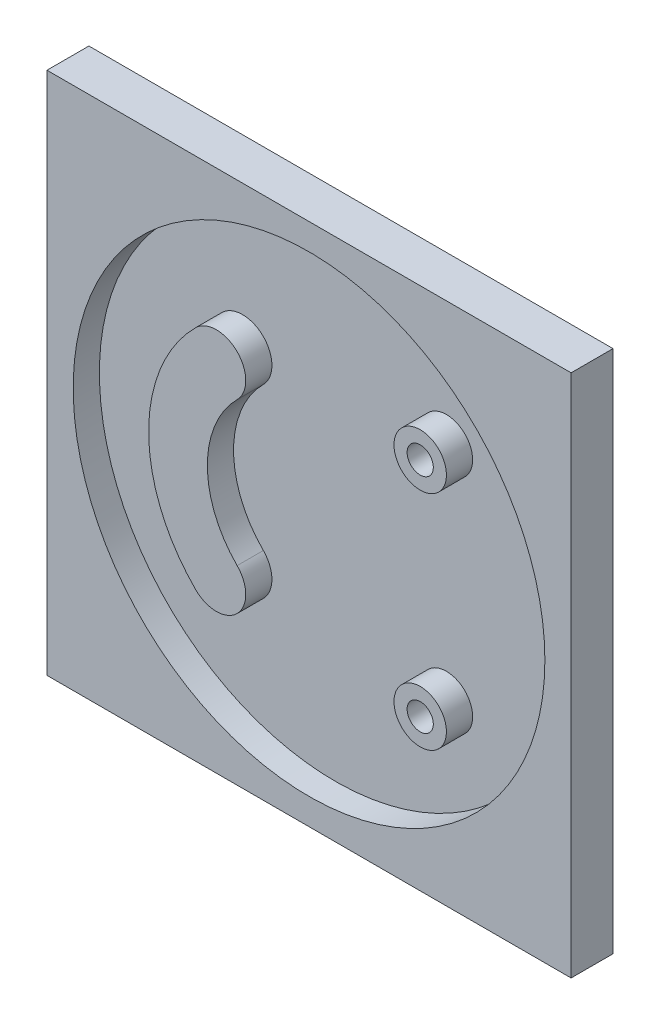
from build123d import *

# Parameters (mm, degrees)
SKETCH1_W                       = 127
SKETCH1_H                       = 127
SKETCH1_R                       = 6.35
BOSS_EXTRUDE1_DEPTH             = 10.16
SKETCH3_R                       = 57.15
CUT_EXTRUDE1_DEPTH              = 6.35
BOSS_EXTRUDE2_REACH             = 181.717
SKETCH4_R                       = 6.35
BOSS_EXTRUDE2_DIRECTION_2_REACH = 181.717
SKETCH5_R                       = 3.175
CUT_EXTRUDE2_DEPTH              = 180.89226109


with BuildPart() as part:
    # Sketch1 → Boss-Extrude1 (new body)
    with BuildSketch(Plane.XY):
        with Locations((63.5, 63.5)):
            Rectangle(SKETCH1_W, SKETCH1_H)
        with Locations((90.440768363, 90.440768363)):
            Circle(SKETCH1_R, mode=Mode.SUBTRACT)
        with Locations((90.440768363, 36.559231637)):
            Circle(SKETCH1_R, mode=Mode.SUBTRACT)
        with BuildLine():
            ThreePointArc((36.020411647, 90.979588353), (24.637993463, 63.5), (36.020411647, 36.020411647))
            ThreePointArc((36.020411647, 36.020411647), (46.078298503, 36.020411647), (46.078298503, 46.078298503))
            ThreePointArc((46.078298503, 46.078298503), (38.861993463, 63.5), (46.078298503, 80.921701497))
            ThreePointArc((46.078298503, 80.921701497), (46.078298503, 90.979588353), (36.020411647, 90.979588353))
        make_face(mode=Mode.SUBTRACT)
    extrude(amount=BOSS_EXTRUDE1_DEPTH)

    # Sketch3 → Cut-Extrude1 (cut)
    with BuildSketch(Plane.XY.offset(10.16)):
        with Locations((63.5, 63.5)):
            Circle(SKETCH3_R)
    extrude(amount=-CUT_EXTRUDE1_DEPTH, mode=Mode.SUBTRACT)

    # Boss-Extrude2: up to this face of the body (flat: up to its plane)
    boss_extrude2_end = Plane(part.part.faces().sort_by_distance((63.5, 1.796051224, 10.16))[0])
    # Sketch4 → Boss-Extrude2 (add, up to the picked face)
    with BuildSketch(Plane.XY.offset(3.81), mode=Mode.PRIVATE) as boss_extrude2_sk1:
        with Locations(Location((90.440768363, 36.559231637, 0), (0, 0, 180))):
            Circle(SKETCH4_R)
    boss_extrude2_tool1 = split(extrude(boss_extrude2_sk1.sketch, amount=BOSS_EXTRUDE2_REACH, mode=Mode.PRIVATE), bisect_by=boss_extrude2_end, keep=Keep.BOTH, mode=Mode.PRIVATE)
    # Sketch4 → Boss-Extrude2 (add, up to the picked face)
    with BuildSketch(Plane.XY.offset(3.81), mode=Mode.PRIVATE) as boss_extrude2_sk2:
        with Locations(Location((90.440768363, 90.440768363, 0), (0, 0, 180))):
            Circle(SKETCH4_R)
    boss_extrude2_tool2 = split(extrude(boss_extrude2_sk2.sketch, amount=BOSS_EXTRUDE2_REACH, mode=Mode.PRIVATE), bisect_by=boss_extrude2_end, keep=Keep.BOTH, mode=Mode.PRIVATE)
    # Sketch4 → Boss-Extrude2 (add, up to the picked face)
    with BuildSketch(Plane.XY.offset(3.81), mode=Mode.PRIVATE) as boss_extrude2_sk3:
        with BuildLine():
            ThreePointArc((46.078298503, 80.921701497), (38.861993463, 63.5), (46.078298503, 46.078298503))
            ThreePointArc((46.078298503, 46.078298503), (46.078298503, 36.020411647), (36.020411647, 36.020411647))
            ThreePointArc((36.020411647, 36.020411647), (24.637993463, 63.5), (36.020411647, 90.979588353))
            ThreePointArc((36.020411647, 90.979588353), (46.078298503, 90.979588353), (46.078298503, 80.921701497))
        make_face()
    boss_extrude2_tool3 = split(extrude(boss_extrude2_sk3.sketch, amount=BOSS_EXTRUDE2_REACH, mode=Mode.PRIVATE), bisect_by=boss_extrude2_end, keep=Keep.BOTH, mode=Mode.PRIVATE)
    add(boss_extrude2_tool1.solids().sort_by(Axis((90.440768, 36.559232, 3.81), (0, 0, 1)))[0])
    add(boss_extrude2_tool2.solids().sort_by(Axis((90.440768, 90.440768, 3.81), (0, 0, 1)))[0])
    add(boss_extrude2_tool3.solids().sort_by(Axis((36.037587, 63.5, 3.81), (0, 0, 1)))[0])

    # Boss-Extrude2 direction 2: up to this face of the body (flat: up to its plane)
    boss_extrude2_direction_2_end = Plane(part.part.faces().sort_by_distance((64.634104548, 63.5, 0))[0])
    # Sketch4 → Boss-Extrude2 direction 2 (add, up to the picked face)
    with BuildSketch(Plane.XY.offset(3.81), mode=Mode.PRIVATE) as boss_extrude2_direction_2_sk1:
        with Locations(Location((90.440768363, 36.559231637, 0), (0, 0, 180))):
            Circle(SKETCH4_R)
    boss_extrude2_direction_2_tool1 = split(extrude(boss_extrude2_direction_2_sk1.sketch, amount=-BOSS_EXTRUDE2_DIRECTION_2_REACH, mode=Mode.PRIVATE), bisect_by=boss_extrude2_direction_2_end, keep=Keep.BOTH, mode=Mode.PRIVATE)
    # Sketch4 → Boss-Extrude2 direction 2 (add, up to the picked face)
    with BuildSketch(Plane.XY.offset(3.81), mode=Mode.PRIVATE) as boss_extrude2_direction_2_sk2:
        with Locations(Location((90.440768363, 90.440768363, 0), (0, 0, 180))):
            Circle(SKETCH4_R)
    boss_extrude2_direction_2_tool2 = split(extrude(boss_extrude2_direction_2_sk2.sketch, amount=-BOSS_EXTRUDE2_DIRECTION_2_REACH, mode=Mode.PRIVATE), bisect_by=boss_extrude2_direction_2_end, keep=Keep.BOTH, mode=Mode.PRIVATE)
    # Sketch4 → Boss-Extrude2 direction 2 (add, up to the picked face)
    with BuildSketch(Plane.XY.offset(3.81), mode=Mode.PRIVATE) as boss_extrude2_direction_2_sk3:
        with BuildLine():
            ThreePointArc((46.078298503, 80.921701497), (38.861993463, 63.5), (46.078298503, 46.078298503))
            ThreePointArc((46.078298503, 46.078298503), (46.078298503, 36.020411647), (36.020411647, 36.020411647))
            ThreePointArc((36.020411647, 36.020411647), (24.637993463, 63.5), (36.020411647, 90.979588353))
            ThreePointArc((36.020411647, 90.979588353), (46.078298503, 90.979588353), (46.078298503, 80.921701497))
        make_face()
    boss_extrude2_direction_2_tool3 = split(extrude(boss_extrude2_direction_2_sk3.sketch, amount=-BOSS_EXTRUDE2_DIRECTION_2_REACH, mode=Mode.PRIVATE), bisect_by=boss_extrude2_direction_2_end, keep=Keep.BOTH, mode=Mode.PRIVATE)
    add(boss_extrude2_direction_2_tool1.solids().sort_by(Axis((90.440768, 36.559232, 3.81), (0, 0, -1)))[0])
    add(boss_extrude2_direction_2_tool2.solids().sort_by(Axis((90.440768, 90.440768, 3.81), (0, 0, -1)))[0])
    add(boss_extrude2_direction_2_tool3.solids().sort_by(Axis((36.037587, 63.5, 3.81), (0, 0, -1)))[0])

    # Sketch5 → Cut-Extrude2 (cut, through all)
    with BuildSketch(Plane.XY.offset(10.16)):
        with Locations((90.440768363, 90.440768363)):
            Circle(SKETCH5_R)
        with Locations((90.440768363, 36.559231637)):
            Circle(SKETCH5_R)
    extrude(amount=-CUT_EXTRUDE2_DEPTH, mode=Mode.SUBTRACT)


solid = part.part
